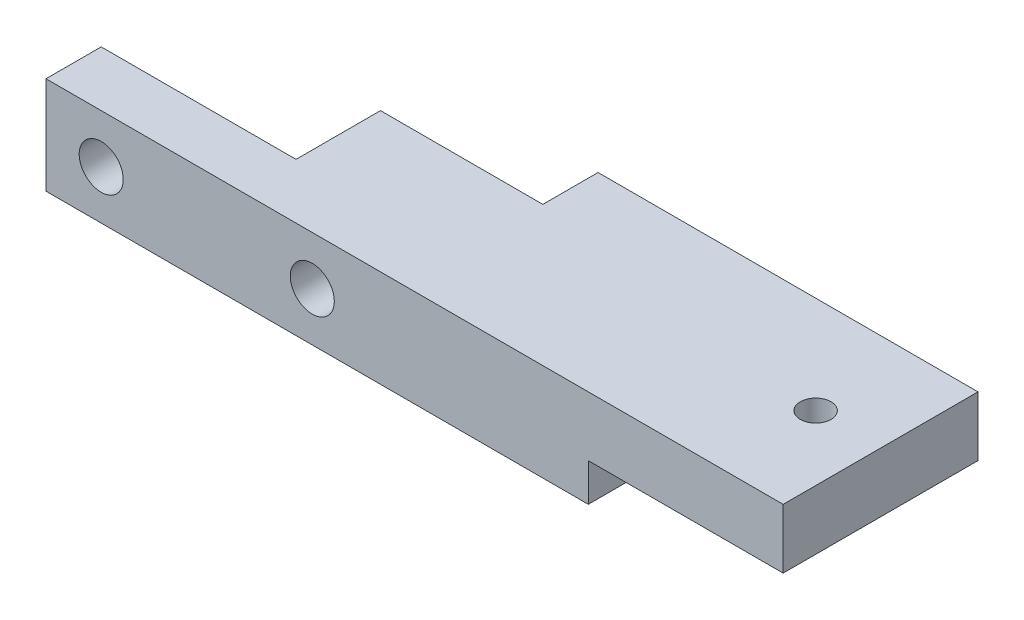
from build123d import *

# Parameters (mm, degrees)
SKETCH1_R           = 1.5
BOSS_EXTRUDE1_DEPTH = 4.7625
SKETCH2_R           = 2.15265
CUT_EXTRUDE1_DEPTH  = 61.429350536
SKETCH3_W           = 19.05
SKETCH3_H           = 19.05
CUT_EXTRUDE2_DEPTH  = 3.699999966


with BuildPart() as part:
    # Sketch1 → Boss-Extrude1 (new, symmetric)
    with BuildSketch(Plane(origin=(0, 0, 0), x_dir=(1, 0, 0), z_dir=(0, 1, 0))):
        Polygon((-14.9225, -4.1275), (-14.9225, -9.525), (57.15, -9.525), (57.15, 9.525), (20.0025, 9.525), (20.0025, 4.1275), (4.1275, 4.1275), (4.1275, -4.1275), align=None)
        with Locations(Location((50.8, 0, 0), (0, 0, 90))):
            Circle(SKETCH1_R, mode=Mode.SUBTRACT)
    extrude(amount=BOSS_EXTRUDE1_DEPTH, both=True)

    # Sketch2 → Cut-Extrude1 (cut, through all)
    with BuildSketch(Plane.XY.offset(9.525)):
        with Locations((-9.525, 0)):
            Circle(SKETCH2_R)
        with Locations((11.1125, 0)):
            Circle(SKETCH2_R)
    extrude(amount=-CUT_EXTRUDE1_DEPTH, mode=Mode.SUBTRACT)

    # Sketch3 → Cut-Extrude2 (cut)
    with BuildSketch(Plane.XZ.offset(4.7625)):
        with Locations((47.625, 0)):
            Rectangle(SKETCH3_W, SKETCH3_H)
    extrude(amount=-CUT_EXTRUDE2_DEPTH, mode=Mode.SUBTRACT)


solid = part.part
